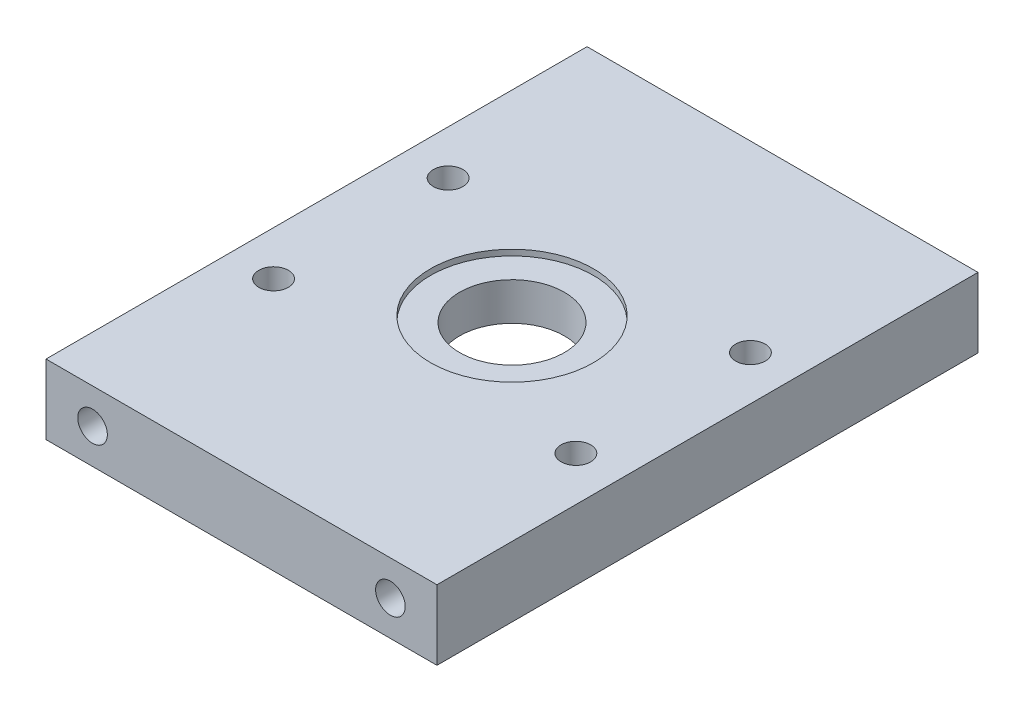
from build123d import *

# Parameters (mm, degrees)
SKETCH2_W                           = 53.34
SKETCH2_H                           = 73.816694632
SKETCH2_R                           = 7.14375
BOSS_EXTRUDE1_DEPTH                 = 9.525
SKETCH3_R                           = 11.1125
CUT_EXTRUDE1_DEPTH                  = 0.79375
SKETCH4_R                           = 12.7
CUT_EXTRUDE2_DEPTH                  = 3.571875
TAP_DRILL_FOR_10_32_TAP1_AT_2_COUNT = 2
TAP_DRILL_FOR_10_32_TAP1_AT_2_PITCH = 40.64
TAP_DRILL_FOR_10_32_TAP2_D          = 4.0386


with BuildPart() as part:
    # Sketch2 → Boss-Extrude1 (new body)
    with BuildSketch(Plane(origin=(0, 0, 0), x_dir=(1, 0, 0), z_dir=(0, 1, 0))):
        Rectangle(SKETCH2_W, SKETCH2_H)
        with Locations(Location((0, 0, 0), (0, 0, 90))):
            Circle(SKETCH2_R, mode=Mode.SUBTRACT)
    extrude(amount=BOSS_EXTRUDE1_DEPTH)

    # Sketch3 → Cut-Extrude1 (cut)
    with BuildSketch(Plane(origin=(0, 9.525, 0), x_dir=(1, 0, 0), z_dir=(0, 1, 0))):
        with Locations(Location((0, 0, 0), (0, 0, 270))):
            Circle(SKETCH3_R)
    extrude(amount=-CUT_EXTRUDE1_DEPTH, mode=Mode.SUBTRACT)

    # Sketch4 → Cut-Extrude2 (cut)
    with BuildSketch(Plane.XZ):
        with Locations(Location((0, 0, 0), (0, 0, 270))):
            Circle(SKETCH4_R)
    extrude(amount=-CUT_EXTRUDE2_DEPTH, mode=Mode.SUBTRACT)

    # Sketch6 → Tap Drill for #10-32 Tap1 (revolve, cut)
    with BuildSketch(Plane(origin=(-20.32, 4.7625, 36.908347316), x_dir=(0, -1, 0), z_dir=(1, 0, 0))):
        Polygon((0, 0), (0, 7.563317848), (2.0193, 6.35), (2.0193, 0), align=None)
    tap_drill_for_10_32_tap1 = revolve(axis=Axis((-20.32, 4.7625, 43.258347316), (0, 0, -1)), mode=Mode.SUBTRACT)

    # Tap Drill for #10-32 Tap1 at 2: Tap Drill for #10-32 Tap1 ×2
    with Locations(*[(i * TAP_DRILL_FOR_10_32_TAP1_AT_2_PITCH, 0, 0) for i in range(1, TAP_DRILL_FOR_10_32_TAP1_AT_2_COUNT)]):
        add(tap_drill_for_10_32_tap1, mode=Mode.SUBTRACT)

    # Mirror1: Tap Drill for #10-32 Tap1 across plane
    add(tap_drill_for_10_32_tap1.mirror(Plane.XY), mode=Mode.SUBTRACT)

    # Mirror1 copy 1 sketch → Mirror1 copy 1 (revolve, cut)
    with BuildSketch(Plane(origin=(20.32, 4.7625, -36.908347316), x_dir=(0, -1, 0), z_dir=(1, 0, 0))):
        Polygon((0, 0), (0, -7.563317848), (2.0193, -6.35), (2.0193, 0), align=None)
    revolve(axis=Axis((20.32, 4.7625, -43.258347316), (0, 0, -1)), mode=Mode.SUBTRACT)

    # Tap Drill for #10-32 Tap2 (through all)
    with Locations(Plane(origin=(0, 9.525, 0), x_dir=(1, 0, 0), z_dir=(0, 1, 0))):
        with Locations((-20.622229928, 11.90625), (-20.622229928, -11.90625), (20.622229928, -11.90625), (20.622229928, 11.90625)):
            Hole(TAP_DRILL_FOR_10_32_TAP2_D / 2)


solid = part.part
